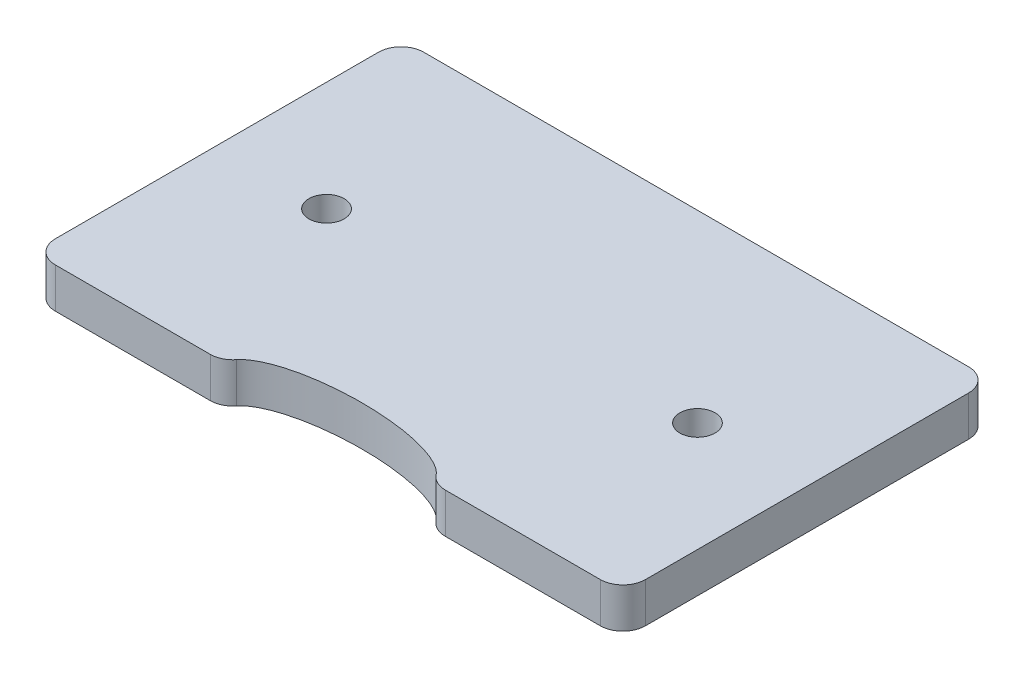
from build123d import *

# Parameters (mm, degrees)
SKETCH1_R           = 1.975
BOSS_EXTRUDE1_DEPTH = 4.5


with BuildPart() as part:
    # Sketch1 → Boss-Extrude1 (new body)
    with BuildSketch(Plane(origin=(0, 0, 0), x_dir=(1, 0, 0), z_dir=(0, 1, 0))):
        with BuildLine():
            Line((30.5816, 20.675), (-30.5816, 20.675))
            ThreePointArc((-30.5816, 20.675), (-32.377651224, 19.931051224), (-33.1216, 18.135))
            Line((-33.1216, 18.135), (-33.1216, -18.135))
            ThreePointArc((-33.1216, -18.135), (-32.377651224, -19.931051224), (-30.5816, -20.675))
            Line((-30.5816, -20.675), (-13.187240763, -20.675))
            ThreePointArc((-13.187240763, -20.675), (-12.081828105, -20.421845613), (-11.196761955, -19.712844768))
            add(Edge.make_bspline(
                [(11.196761955, -19.712844768), (8.939286543, -16.865), (0, -16.865), (-8.939286543, -16.865), (-11.196761955, -19.712844768)],
                knots=[3.396891088, 3.396891088, 3.396891088, 4.71238898, 4.71238898, 6.027886873, 6.027886873, 6.027886873], degree=2, weights=[1, 0.791370388, 1, 0.791370388, 1]))
            ThreePointArc((11.196761955, -19.712844768), (12.081828105, -20.421845613), (13.187240763, -20.675))
            Line((13.187240763, -20.675), (30.5816, -20.675))
            ThreePointArc((30.5816, -20.675), (32.377651224, -19.931051224), (33.1216, -18.135))
            Line((33.1216, -18.135), (33.1216, 18.135))
            ThreePointArc((33.1216, 18.135), (32.377651224, 19.931051224), (30.5816, 20.675))
        make_face()
        with Locations(Location((-20.8153, 0, 0), (0, 0, 270))):
            Circle(SKETCH1_R, mode=Mode.SUBTRACT)
        with Locations(Location((20.8153, 0, 0), (0, 0, 90))):
            Circle(SKETCH1_R, mode=Mode.SUBTRACT)
    extrude(amount=BOSS_EXTRUDE1_DEPTH)


solid = part.part
